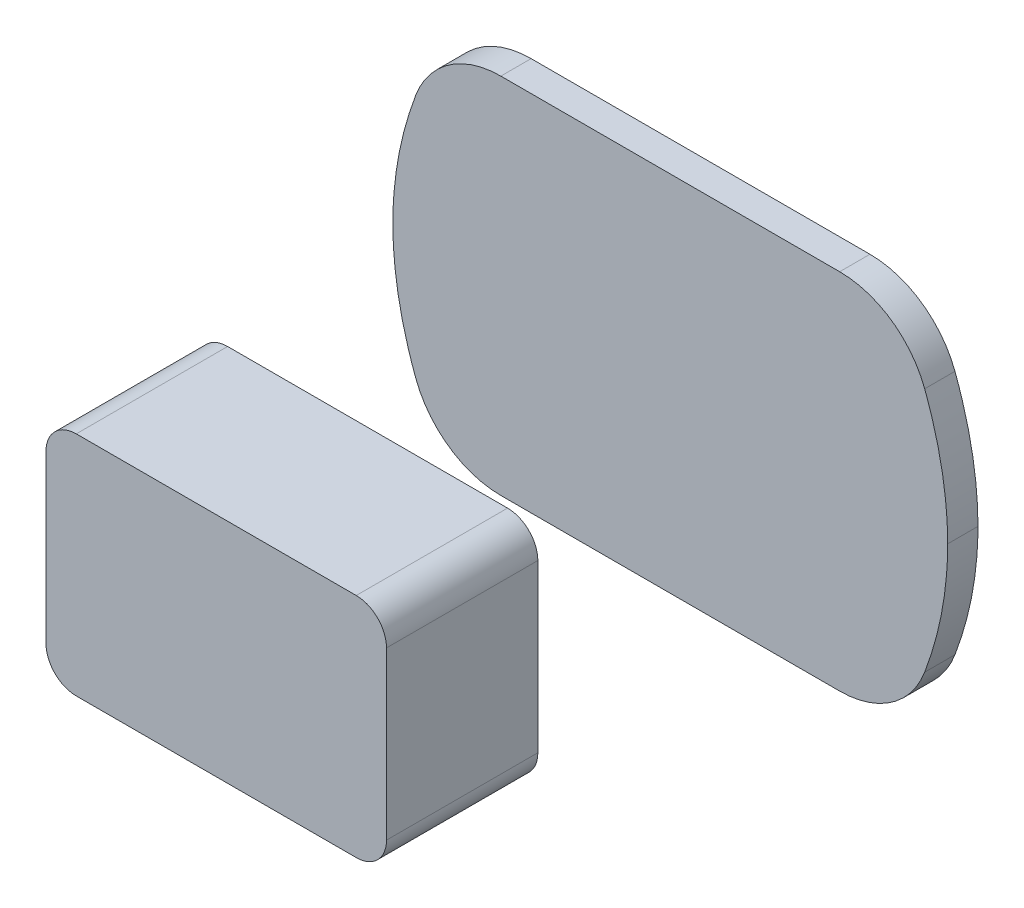
from build123d import *

# Parameters (mm, degrees)
BOSS_EXTRUDE1_DEPTH = 10
BOSS_EXTRUDE2_START = -2
SKETCH7_W           = 17.267499136
SKETCH7_H           = 10.808758156
BOSS_EXTRUDE2_DEPTH = 2
BOSS_EXTRUDE7_DEPTH = 2
BOSS_EXTRUDE9_START = -2
BOSS_EXTRUDE9_DEPTH = 2


with BuildPart() as part:
    # Sketch6 → Boss-Extrude1 (new body)
    with BuildSketch(Plane.XY.offset(20)):
        with BuildLine():
            Line((-9.25, -7.5), (9.25, -7.5))
            ThreePointArc((9.25, -7.5), (10.664213562, -6.914213562), (11.25, -5.5))
            Line((11.25, -5.5), (11.25, 5.5))
            ThreePointArc((11.25, 5.5), (10.664213562, 6.914213562), (9.25, 7.5))
            Line((9.25, 7.5), (-9.25, 7.5))
            ThreePointArc((-9.25, 7.5), (-10.664213562, 6.914213562), (-11.25, 5.5))
            Line((-11.25, 5.5), (-11.25, -5.5))
            ThreePointArc((-11.25, -5.5), (-10.664213562, -6.914213562), (-9.25, -7.5))
        make_face()
    extrude(amount=BOSS_EXTRUDE1_DEPTH)

    # Sketch7 → Boss-Extrude2 (add)
    with BuildSketch(Plane.XY.offset(27.8).offset(BOSS_EXTRUDE2_START)):
        with BuildLine():
            Line((9.25, -7.5), (-9.25, -7.5))
            ThreePointArc((-9.25, -7.5), (-10.664213562, -6.914213562), (-11.25, -5.5))
            Line((-11.25, -5.5), (-11.25, 5.5))
            ThreePointArc((-11.25, 5.5), (-10.664213562, 6.914213562), (-9.25, 7.5))
            Line((-9.25, 7.5), (9.25, 7.5))
            ThreePointArc((9.25, 7.5), (10.664213562, 6.914213562), (11.25, 5.5))
            Line((11.25, 5.5), (11.25, -5.5))
            ThreePointArc((11.25, -5.5), (10.664213562, -6.914213562), (9.25, -7.5))
        make_face()
        Rectangle(SKETCH7_W, SKETCH7_H, mode=Mode.SUBTRACT)
    extrude(amount=BOSS_EXTRUDE2_DEPTH)

    # Sketch19 → Boss-Extrude9 (add)
    with BuildSketch(Plane.XY.offset(27.8).offset(BOSS_EXTRUDE9_START)):
        with BuildLine():
            Line((-9.25, -7.5), (9.25, -7.5))
            ThreePointArc((9.25, -7.5), (10.664213562, -6.914213562), (11.25, -5.5))
            Line((11.25, -5.5), (11.25, 5.5))
            ThreePointArc((11.25, 5.5), (10.664213562, 6.914213562), (9.25, 7.5))
            Line((9.25, 7.5), (-9.25, 7.5))
            ThreePointArc((-9.25, 7.5), (-10.664213562, 6.914213562), (-11.25, 5.5))
            Line((-11.25, 5.5), (-11.25, -5.5))
            ThreePointArc((-11.25, -5.5), (-10.664213562, -6.914213562), (-9.25, -7.5))
        make_face()
        Polygon((-8.846713109, -6.835339728), (8.846713109, -6.835339728), (8.846713109, 6.835339728), (-8.846713109, 6.835339728), (-8.846713109, 3.299585285), (-10.877917398, 3.299585285), (-10.877917398, -3.536837454), (-8.846713109, -3.536837454), align=None, mode=Mode.SUBTRACT)
    extrude(amount=BOSS_EXTRUDE9_DEPTH)


with BuildPart() as body_2:
    # Sketch1 → Boss-Extrude7 (new body)
    with BuildSketch(Plane.XY):
        with BuildLine():
            Line((-11.194828593, 12), (11.194828593, 12))
            ThreePointArc((11.194828593, 12), (14.611088975, 10.932460339), (16.811684874, 8.109721667))
            add(Edge.make_bspline(
                [(18.334712598, 0), (18.327162711, 2.726130661), (17.81951085, 5.426517645), (16.811684874, 8.109721667)],
                knots=[0.502499344, 0.502499344, 0.502499344, 0.502499344, 0.837905074, 0.837905074, 0.837905074, 0.837905074], degree=3))
            add(Edge.make_bspline(
                [(18.334712598, 0), (18.327162711, -2.726130661), (17.81951085, -5.426517645), (16.811684874, -8.109721667)],
                knots=[0.502499344, 0.502499344, 0.502499344, 0.502499344, 0.837905074, 0.837905074, 0.837905074, 0.837905074], degree=3))
            ThreePointArc((16.811684874, -8.109721667), (14.611088975, -10.932460339), (11.194828593, -12))
            Line((11.194828593, -12), (-11.194828593, -12))
            ThreePointArc((-11.194828593, -12), (-14.611088975, -10.932460339), (-16.811684874, -8.109721667))
            add(Edge.make_bspline(
                [(-18.334712598, 0), (-18.327162711, -2.726130661), (-17.81951085, -5.426517645), (-16.811684874, -8.109721667)],
                knots=[0.502499344, 0.502499344, 0.502499344, 0.502499344, 0.837905074, 0.837905074, 0.837905074, 0.837905074], degree=3))
            add(Edge.make_bspline(
                [(-18.334712598, 0), (-18.327162711, 2.726130661), (-17.81951085, 5.426517645), (-16.811684874, 8.109721667)],
                knots=[0.502499344, 0.502499344, 0.502499344, 0.502499344, 0.837905074, 0.837905074, 0.837905074, 0.837905074], degree=3))
            ThreePointArc((-16.811684874, 8.109721667), (-14.611088975, 10.932460339), (-11.194828593, 12))
        make_face()
    extrude(amount=-BOSS_EXTRUDE7_DEPTH)


solid = Compound([part.part, body_2.part])
